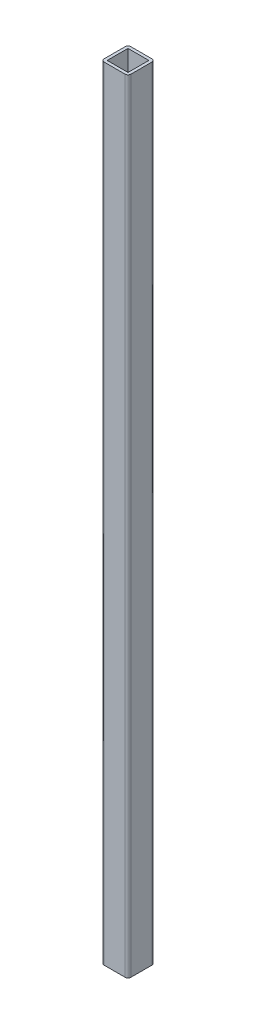
from build123d import *

# Parameters (mm, degrees)
BOSS_EXTRUDE1_DEPTH = 750.2
SKETCH3_W           = 20
SKETCH3_H           = 20
CUT_EXTRUDE1_DEPTH  = 750.2


with BuildPart() as part:
    # Sketch1 → Boss-Extrude1 (new body)
    with BuildSketch(Plane(origin=(0, 0, 0), x_dir=(1, 0, 0), z_dir=(0, 1, 0))):
        with BuildLine():
            Line((2.8, 0), (22.8, 0))
            ThreePointArc((22.8, 0), (24.779898987, -0.820101013), (25.6, -2.8))
            Line((25.6, -2.8), (25.6, -22.8))
            ThreePointArc((25.6, -22.8), (24.779898987, -24.779898987), (22.8, -25.6))
            Line((22.8, -25.6), (2.8, -25.6))
            ThreePointArc((2.8, -25.6), (0.820101013, -24.779898987), (0, -22.8))
            Line((0, -22.8), (0, -2.8))
            ThreePointArc((0, -2.8), (0.820101013, -0.820101013), (2.8, 0))
        make_face()
    extrude(amount=BOSS_EXTRUDE1_DEPTH)

    # Sketch3 → Cut-Extrude1 (cut)
    with BuildSketch(Plane(origin=(0, 0, 0), x_dir=(-1, 0, 0), z_dir=(0, -1, 0))):
        with Locations((-12.8, -12.8)):
            Rectangle(SKETCH3_W, SKETCH3_H)
    extrude(amount=-CUT_EXTRUDE1_DEPTH, mode=Mode.SUBTRACT)


solid = part.part
